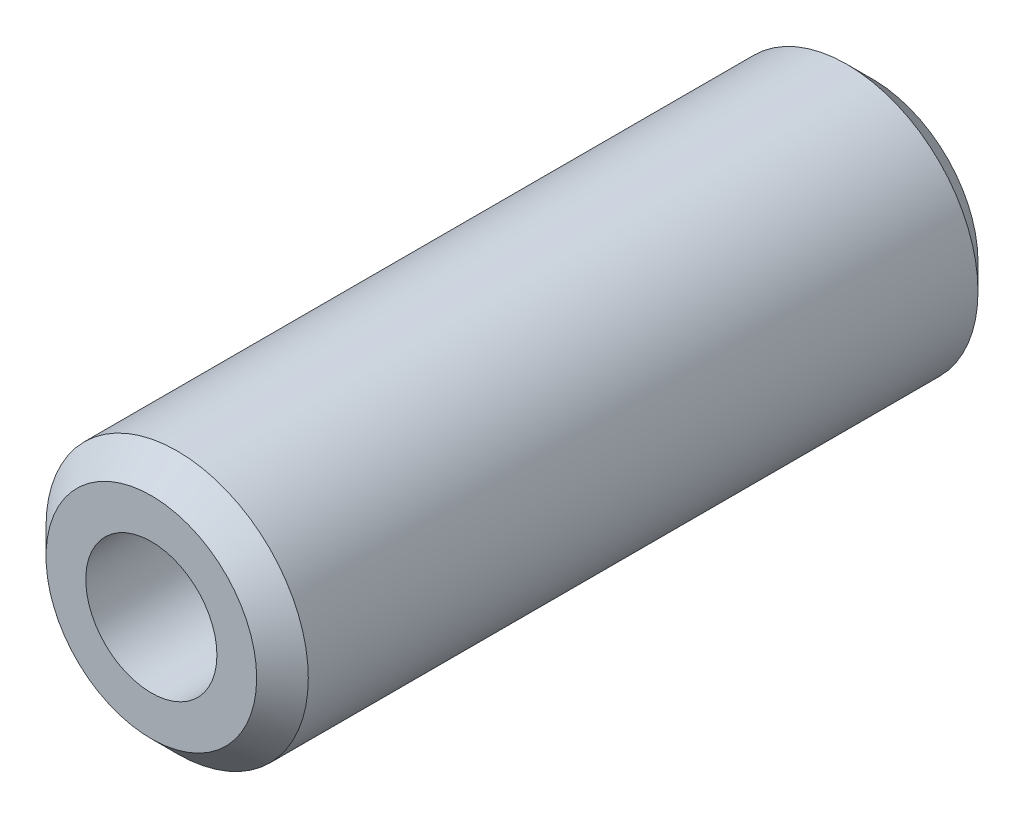
from build123d import *

# Parameters (mm, degrees)
SKETCH2_R           = 12.7
SKETCH2_R_2         = 6.35
BOSS_EXTRUDE1_DEPTH = 34.925
CHAMFER1_SIZE       = 2.5


with BuildPart() as part:
    # Sketch2 → Boss-Extrude1 (new, symmetric)
    with BuildSketch(Plane.XY):
        Circle(SKETCH2_R)
        Circle(SKETCH2_R_2, mode=Mode.SUBTRACT)
    extrude(amount=BOSS_EXTRUDE1_DEPTH, both=True)

    # Chamfer1
    chamfer1_edges = [part.edges().sort_by_distance(p)[0] for p in [
        (-12.7, 0, -34.925),
        (-12.7, 0, 34.925),
    ]]
    chamfer(chamfer1_edges, length=CHAMFER1_SIZE)


solid = part.part
